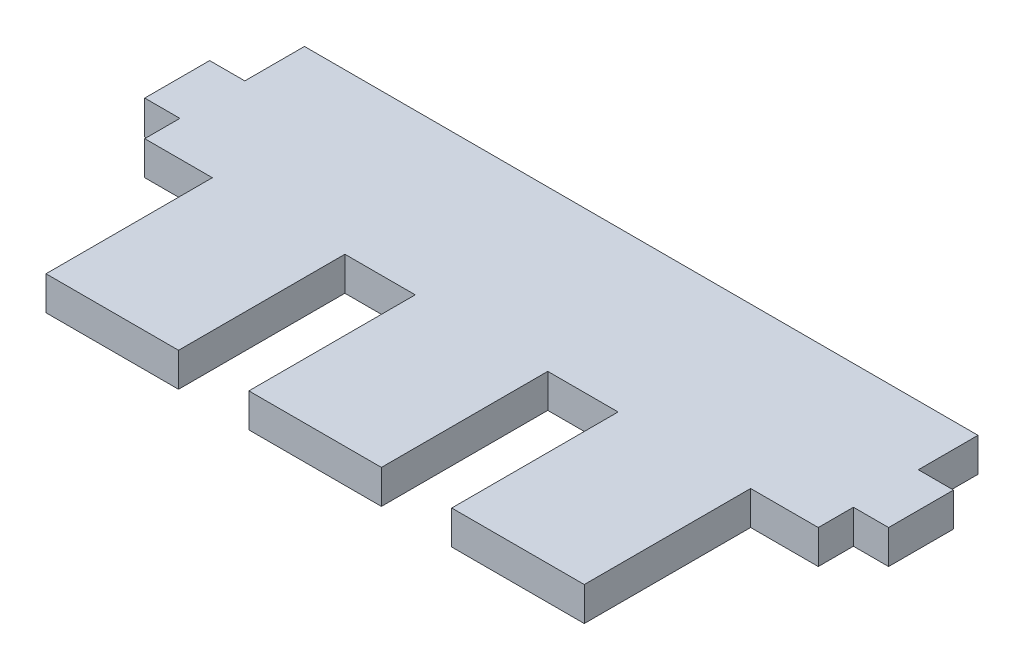
from build123d import *

# Parameters (mm, degrees)
SKETCH1_W           = 139.7
SKETCH1_H           = 57.15
BOSS_EXTRUDE1_DEPTH = 6.35
SKETCH3_W           = 24.892
SKETCH3_H           = 31.242
BOSS_EXTRUDE2_DEPTH = 6.35
SKETCH4_W           = 13.208
SKETCH4_H           = 13.208
CUT_EXTRUDE2_DEPTH  = 93.181443301
SKETCH5_W           = 295.464136086
SKETCH5_H           = 12.7
CUT_EXTRUDE3_DEPTH  = 93.181443301
SKETCH6_W           = 139.7
SKETCH6_H           = 12.446
BOSS_EXTRUDE3_DEPTH = 6.35
SKETCH7_W           = 139.7
SKETCH7_H           = 14.45
CUT_EXTRUDE4_DEPTH  = 93.181443301


with BuildPart() as part:
    # Sketch1 → Boss-Extrude1 (new body)
    with BuildSketch(Plane(origin=(0, 0, 0), x_dir=(1, 0, 0), z_dir=(0, 1, 0))):
        Rectangle(SKETCH1_W, SKETCH1_H)
    extrude(amount=BOSS_EXTRUDE1_DEPTH)

    # Sketch3 → Boss-Extrude2 (add)
    with BuildSketch(Plane(origin=(0, 0, 0), x_dir=(1, 0, 0), z_dir=(0, 1, 0))):
        with Locations((-38.1, -44.196)):
            Rectangle(SKETCH3_W, SKETCH3_H)
        with Locations((0, -44.196)):
            Rectangle(SKETCH3_W, SKETCH3_H)
        with Locations((38.1, -44.196)):
            Rectangle(SKETCH3_W, SKETCH3_H)
    extrude(amount=BOSS_EXTRUDE2_DEPTH)

    # Sketch4 → Cut-Extrude2 (cut, through all)
    with BuildSketch(Plane(origin=(0, 0, 0), x_dir=(1, 0, 0), z_dir=(0, 1, 0))):
        with Locations((69.85, 22.225)):
            Rectangle(SKETCH4_W, SKETCH4_H)
        with Locations((-69.85, -28.575)):
            Rectangle(SKETCH4_W, SKETCH4_H)
        with Locations((69.85, -3.175)):
            Rectangle(SKETCH4_W, SKETCH4_H)
        with Locations((69.85, -28.575)):
            Rectangle(SKETCH4_W, SKETCH4_H)
        with Locations((-69.85, -3.175)):
            Rectangle(SKETCH4_W, SKETCH4_H)
        with Locations((-69.85, 22.225)):
            Rectangle(SKETCH4_W, SKETCH4_H)
    extrude(amount=CUT_EXTRUDE2_DEPTH, mode=Mode.SUBTRACT)

    # Sketch5 → Cut-Extrude3 (cut, through all)
    with BuildSketch(Plane(origin=(0, 6.35, 0), x_dir=(1, 0, 0), z_dir=(0, 1, 0))):
        with Locations((7.963252738, 22.225)):
            Rectangle(SKETCH5_W, SKETCH5_H)
    extrude(amount=-CUT_EXTRUDE3_DEPTH, mode=Mode.SUBTRACT)

    # Sketch6 → Boss-Extrude3 (add)
    with BuildSketch(Plane(origin=(0, 6.35, 0), x_dir=(1, 0, 0), z_dir=(0, 1, 0))):
        with Locations((0, 9.652)):
            Rectangle(SKETCH6_W, SKETCH6_H)
    extrude(amount=-BOSS_EXTRUDE3_DEPTH)

    # Sketch7 → Cut-Extrude4 (cut, through all)
    with BuildSketch(Plane(origin=(0, 6.35, 0), x_dir=(1, 0, 0), z_dir=(0, 1, 0))):
        with Locations((0, 8.65)):
            Rectangle(SKETCH7_W, SKETCH7_H)
    extrude(amount=-CUT_EXTRUDE4_DEPTH, mode=Mode.SUBTRACT)


solid = part.part
